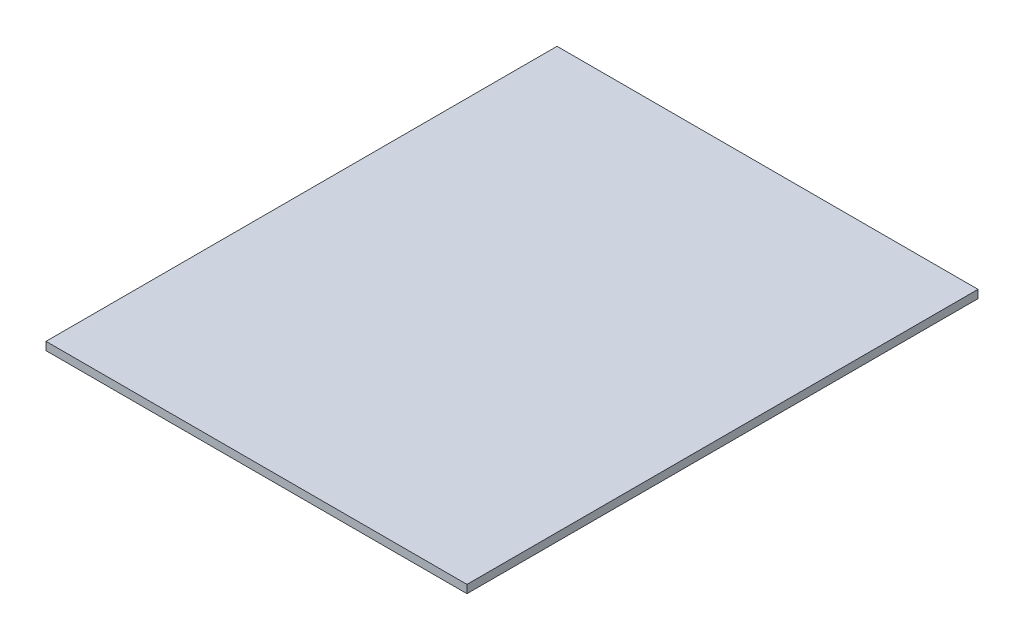
from build123d import *

# Parameters (mm, degrees)
SKETCH1_W           = 624
SKETCH1_H           = 12
DET_RAF_ALT_1_DEPTH = 757.5


with BuildPart() as part:
    # Sketch1 → DET_raf_alt_1 (new body)
    with BuildSketch(Plane.XY):
        with Locations((1026, 1503)):
            Rectangle(SKETCH1_W, SKETCH1_H)
    extrude(amount=-DET_RAF_ALT_1_DEPTH)


solid = part.part
